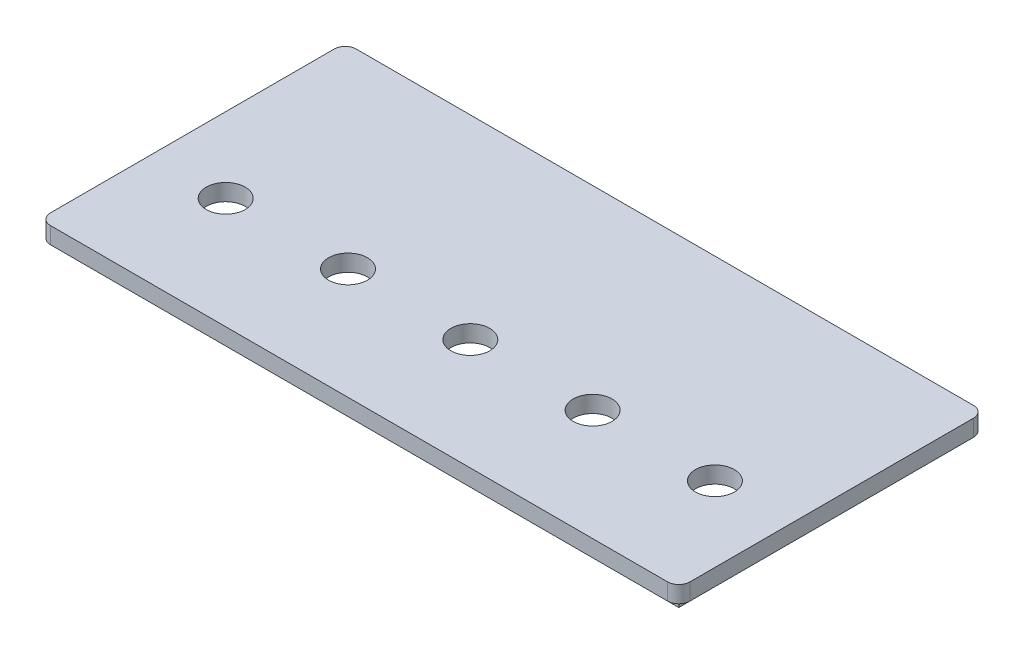
from build123d import *

# Parameters (mm, degrees)
SKETCH_1_W          = 115
SKETCH_1_H          = 55
EXTRUDE_1_DEPTH     = 3
SKETCH_2_R          = 3.5
CUT_EXTRUDE_1_DEPTH = 3
SKETCH_4_W          = 111
SKETCH_4_H          = 51
SKETCH_4_W_2        = 107
SKETCH_4_H_2        = 47
EXTRUDE_2_DEPTH     = 2
FILLET_1_R          = 2


with BuildPart() as part:
    # 草图1 → 凸台-拉伸1 (new body)
    with BuildSketch(Plane(origin=(0, 0, 0), x_dir=(1, 0, 0), z_dir=(0, 1, 0))):
        Rectangle(SKETCH_1_W, SKETCH_1_H)
    extrude(amount=EXTRUDE_1_DEPTH)

    # 草图2 → 切除-拉伸1 (cut)
    with BuildSketch(Plane(origin=(0, 3, 0), x_dir=(1, 0, 0), z_dir=(0, 1, 0))):
        with Locations(Location((-44, -7.5, 0), (0, 0, 270))):
            Circle(SKETCH_2_R)
        with Locations(Location((-22, -7.5, 0), (0, 0, 270))):
            Circle(SKETCH_2_R)
        with Locations(Location((0, -7.5, 0), (0, 0, 270))):
            Circle(SKETCH_2_R)
        with Locations(Location((22, -7.5, 0), (0, 0, 270))):
            Circle(SKETCH_2_R)
        with Locations(Location((44, -7.5, 0), (0, 0, 270))):
            Circle(SKETCH_2_R)
    extrude(amount=-CUT_EXTRUDE_1_DEPTH, mode=Mode.SUBTRACT)

    # 草图4 → 凸台-拉伸2 (add)
    with BuildSketch(Plane.XZ):
        Rectangle(SKETCH_4_W, SKETCH_4_H)
        Rectangle(SKETCH_4_W_2, SKETCH_4_H_2, mode=Mode.SUBTRACT)
    extrude(amount=EXTRUDE_2_DEPTH)

    # 圆角1
    fillet_1_edges = [part.edges().sort_by_distance(p)[0] for p in [
        (57.5, 1.5, 27.5),
        (-57.5, 1.5, 27.5),
        (-57.5, 1.5, -27.5),
        (57.5, 1.5, -27.5),
    ]]
    fillet(fillet_1_edges, radius=FILLET_1_R)


solid = part.part
